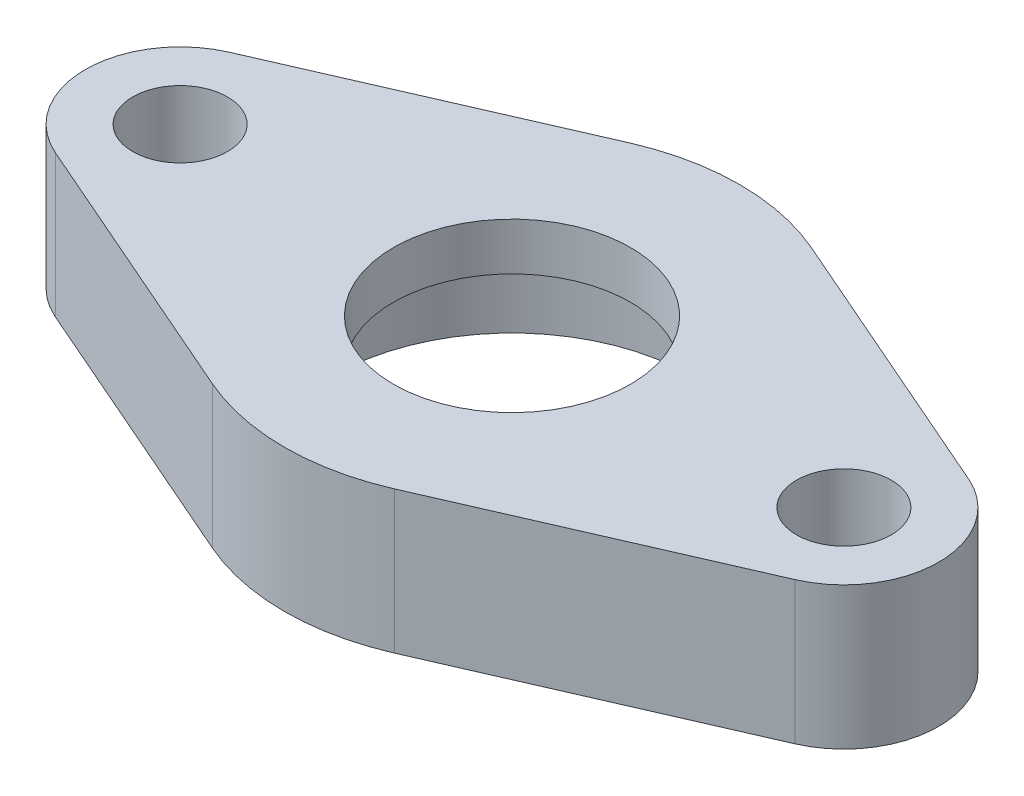
from build123d import *

# Parameters (mm, degrees)
SKETCH1_R           = 2
SKETCH1_R_2         = 9.6
SKETCH1_R_3         = 7.6
BOSS_EXTRUDE1_DEPTH = 4
SKETCH2_R           = 5
SKETCH2_R_2         = 2
BOSS_EXTRUDE2_DEPTH = 2


with BuildPart() as part:
    # Sketch1 → Boss-Extrude1 (new body)
    # profile 1 of 3: a face of its own
    with BuildSketch(Plane(origin=(0, 0, 0), x_dir=(1, 0, 0), z_dir=(0, 1, 0))):
        with BuildLine():
            ThreePointArc((-3.84, -8.798545334), (-9.6, 0), (-3.84, 8.798545334))
            Line((-3.84, 8.798545334), (-15.6, 3.666060556))
            ThreePointArc((-15.6, 3.666060556), (-18, 0), (-15.6, -3.666060556))
            Line((-15.6, -3.666060556), (-3.84, -8.798545334))
        make_face()
        with Locations(Location((-14, 0, 0), (0, 0, 270))):
            Circle(SKETCH1_R, mode=Mode.SUBTRACT)
    # profile 2 of 3: a face of its own
    with BuildSketch(Plane(origin=(0, 0, 0), x_dir=(1, 0, 0), z_dir=(0, 1, 0))):
        Circle(SKETCH1_R_2)
        with Locations(Location((0, 0, 0), (0, 0, 270))):
            Circle(SKETCH1_R_3, mode=Mode.SUBTRACT)
    # profile 3 of 3: a face of its own
    with BuildSketch(Plane(origin=(0, 0, 0), x_dir=(1, 0, 0), z_dir=(0, 1, 0))):
        with BuildLine():
            Line((15.6, 3.666060556), (3.84, 8.798545334))
            ThreePointArc((3.84, 8.798545334), (8.031936255, 5.258136552), (9.6, 0))
            ThreePointArc((9.6, 0), (8.031936255, -5.258136552), (3.84, -8.798545334))
            Line((3.84, -8.798545334), (15.6, -3.666060556))
            ThreePointArc((15.6, -3.666060556), (18, 0), (15.6, 3.666060556))
        make_face()
        with Locations(Location((14, 0, 0), (0, 0, 270))):
            Circle(SKETCH1_R, mode=Mode.SUBTRACT)
    extrude(amount=BOSS_EXTRUDE1_DEPTH)

    # Sketch2 → Boss-Extrude2 (add)
    with BuildSketch(Plane(origin=(0, 4, 0), x_dir=(1, 0, 0), z_dir=(0, 1, 0))):
        with BuildLine():
            Line((-3.84, 8.798545334), (-15.6, 3.666060556))
            ThreePointArc((-15.6, 3.666060556), (-18, 0), (-15.6, -3.666060556))
            Line((-15.6, -3.666060556), (-3.84, -8.798545334))
            ThreePointArc((-3.84, -8.798545334), (0, -9.6), (3.84, -8.798545334))
            Line((3.84, -8.798545334), (15.6, -3.666060556))
            ThreePointArc((15.6, -3.666060556), (18, 0), (15.6, 3.666060556))
            Line((15.6, 3.666060556), (3.84, 8.798545334))
            ThreePointArc((3.84, 8.798545334), (0, 9.6), (-3.84, 8.798545334))
        make_face()
        with Locations(Location((0, 0, 0), (0, 0, 270))):
            Circle(SKETCH2_R, mode=Mode.SUBTRACT)
        with Locations(Location((-14, 0, 0), (0, 0, 270))):
            Circle(SKETCH2_R_2, mode=Mode.SUBTRACT)
        with Locations(Location((14, 0, 0), (0, 0, 270))):
            Circle(SKETCH2_R_2, mode=Mode.SUBTRACT)
    extrude(amount=BOSS_EXTRUDE2_DEPTH)


solid = part.part
